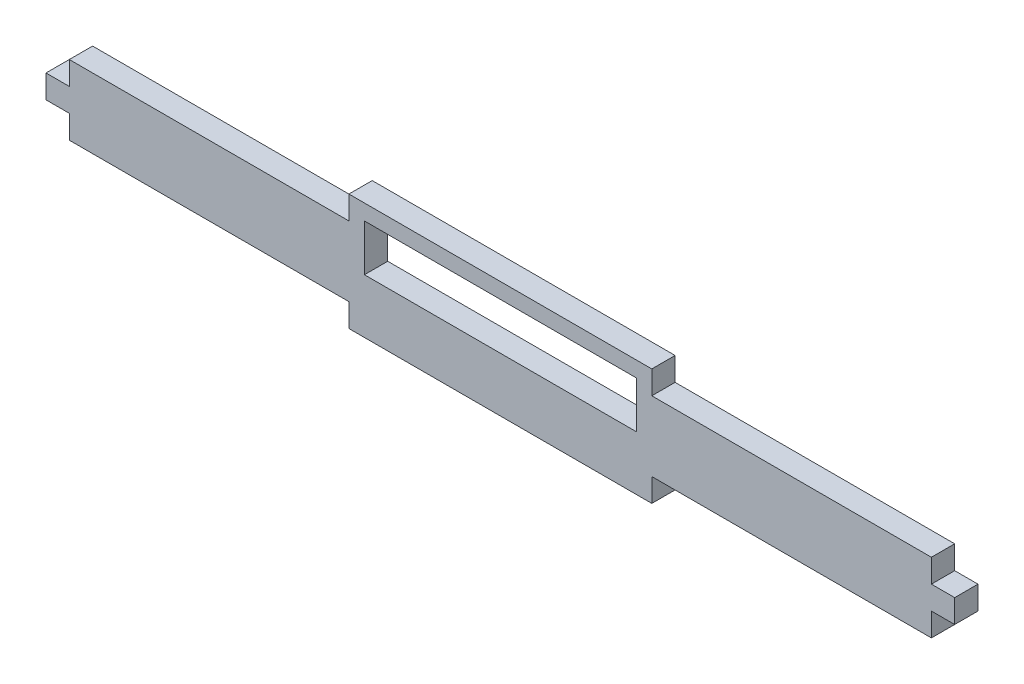
from build123d import *

# Parameters (mm, degrees)
SKETCH1_W           = 35
SKETCH1_H           = 6
BOSS_EXTRUDE1_DEPTH = 3


with BuildPart() as part:
    # Sketch1 → Boss-Extrude1 (new body)
    with BuildSketch(Plane.XY):
        Polygon((-19.5, -7.5), (19.5, -7.5), (19.5, -4.5), (55.5, -4.5), (55.5, -1.5), (58.5, -1.5), (58.5, 1.5), (55.5, 1.5), (55.5, 4.5), (19.5, 4.5), (19.5, 7.5), (-19.5, 7.5), (-19.5, 4.5), (-55.5, 4.5), (-55.5, 1.5), (-58.5, 1.5), (-58.5, -1.5), (-55.5, -1.5), (-55.5, -4.5), (-19.5, -4.5), align=None)
        with Locations((0, 2.5)):
            Rectangle(SKETCH1_W, SKETCH1_H, mode=Mode.SUBTRACT)
    extrude(amount=BOSS_EXTRUDE1_DEPTH)


solid = part.part
